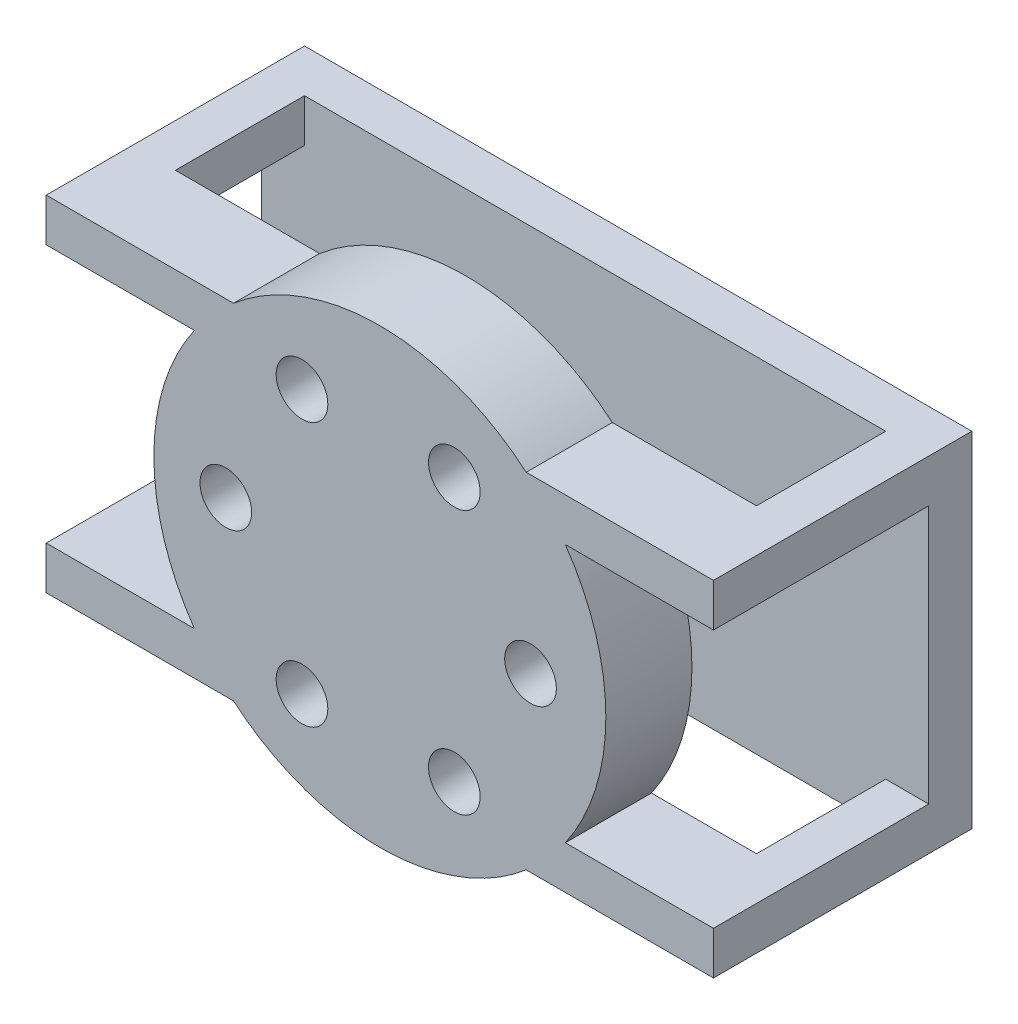
from build123d import *

# Parameters (mm, degrees)
BOSS_EXTRUDE1_DEPTH      = 77.5
BOSS_EXTRUDE1_DEPTH_BACK = 77.5
SKETCH2_R                = 52.5
BOSS_EXTRUDE2_DEPTH      = 20
SKETCH3_W                = 135
SKETCH3_H                = 30
CUT_EXTRUDE1_DEPTH       = 135.768319719
HOLE1_D                  = 12
HOLE1_DEPTH              = 20
CIRPATTERN1_COUNT        = 6


with BuildPart() as part:
    # Sketch1 → Boss-Extrude1 (new, two sides: drawn at the far end of the back side and taken through both)
    with BuildSketch(Plane(origin=(0, 0, 0), x_dir=(0, 0, -1), z_dir=(1, 0, 0)).offset(-BOSS_EXTRUDE1_DEPTH_BACK)):
        Polygon((0, 40), (60, 40), (60, -40), (0, -40), (0, -30), (50, -30), (50, 30), (0, 30), align=None)
    extrude(amount=BOSS_EXTRUDE1_DEPTH + BOSS_EXTRUDE1_DEPTH_BACK)

    # Sketch2 → Boss-Extrude2 (add)
    with BuildSketch(Plane.XY):
        Circle(SKETCH2_R)
    extrude(amount=-BOSS_EXTRUDE2_DEPTH)

    # Sketch3 → Cut-Extrude1 (cut, through all)
    with BuildSketch(Plane(origin=(0, 40, 0), x_dir=(1, 0, 0), z_dir=(0, 1, 0))):
        with Locations((0, 35)):
            Rectangle(SKETCH3_W, SKETCH3_H)
    extrude(amount=-CUT_EXTRUDE1_DEPTH, mode=Mode.SUBTRACT)

    # Hole1
    with Locations(Plane.XY):
        with Locations((35, 0)):
            hole1 = Hole(HOLE1_D / 2, depth=HOLE1_DEPTH)

    # CirPattern1: Hole1 ×6 about axis
    cirpattern1_axis = Axis((-0.392370816, 0, 0), (0, 0, 1))
    for i in range(1, CIRPATTERN1_COUNT):
        add(hole1.rotate(cirpattern1_axis, i * 360 / CIRPATTERN1_COUNT), mode=Mode.SUBTRACT)


solid = part.part
